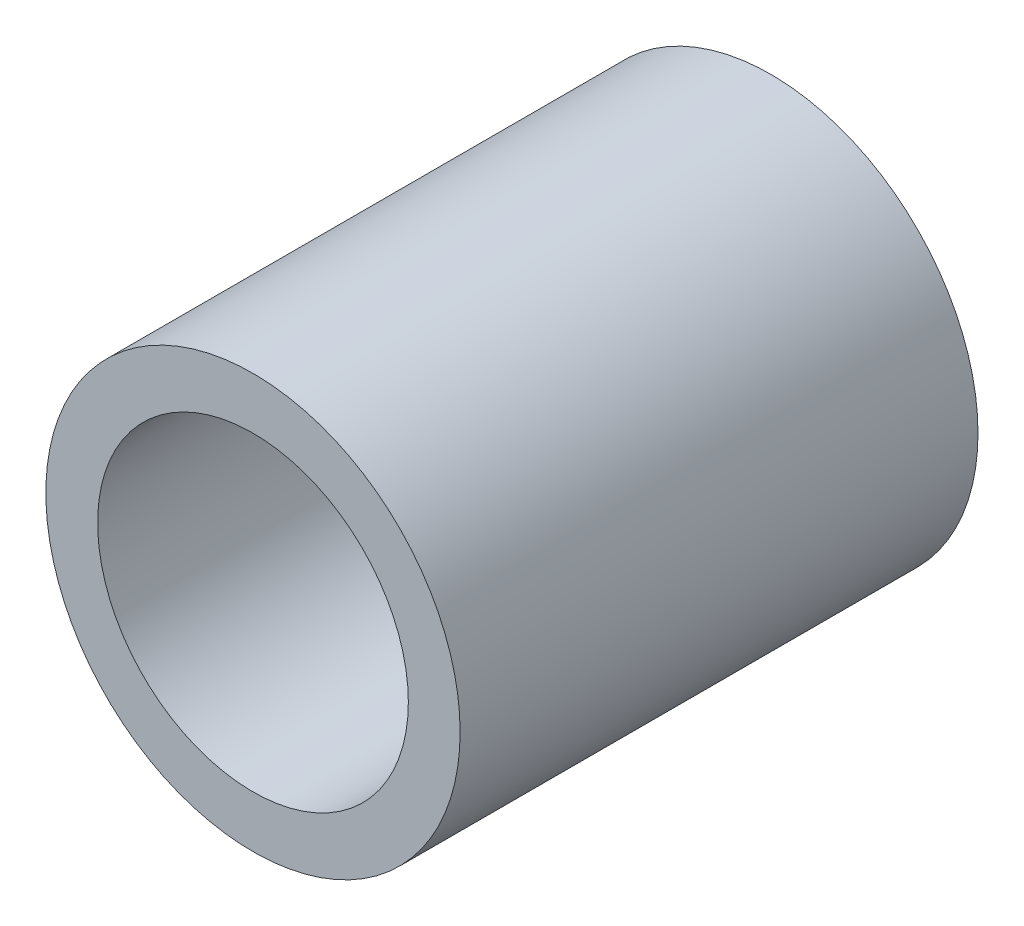
from build123d import *

# Parameters (mm, degrees)
ESQUISSE1_R             = 2.4
BOSS_EXTRU_1_DEPTH      = 6
ESQUISSE2_R             = 1.8
ENL_V_MAT_EXTRU_1_DEPTH = 6


with BuildPart() as part:
    # Esquisse1 → Boss.-Extru.1 (new body)
    with BuildSketch(Plane.XY):
        with Locations((-1.260256582, 1.685114141)):
            Circle(ESQUISSE1_R)
    extrude(amount=BOSS_EXTRU_1_DEPTH)

    # Esquisse2 → Enlèv. mat.-Extru.1 (cut)
    with BuildSketch(Plane.XY):
        with Locations((-1.260256582, 1.685114141)):
            Circle(ESQUISSE2_R)
    extrude(amount=ENL_V_MAT_EXTRU_1_DEPTH, mode=Mode.SUBTRACT)


solid = part.part
